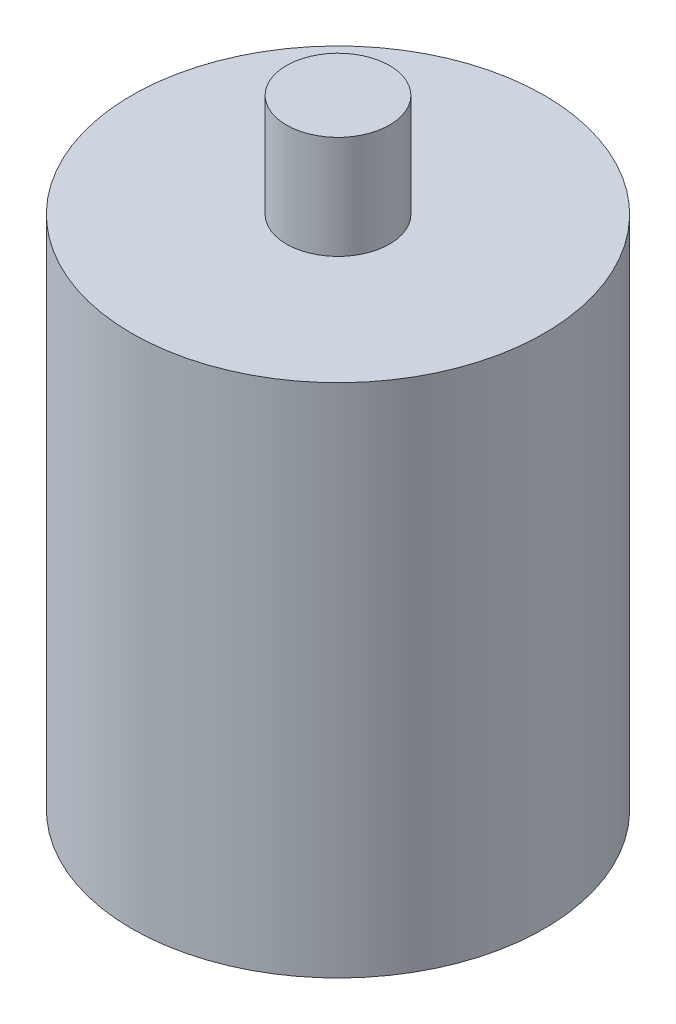
from build123d import *

# Parameters (mm, degrees)
SKETCH1_R           = 20
BOSS_EXTRUDE1_DEPTH = 50
SKETCH2_R           = 5
BOSS_EXTRUDE2_DEPTH = 10
SKETCH3_R           = 1.5
CUT_EXTRUDE1_DEPTH  = 16


with BuildPart() as part:
    # Sketch1 → Boss-Extrude1 (new body)
    with BuildSketch(Plane(origin=(0, 0, 0), x_dir=(1, 0, 0), z_dir=(0, 1, 0))):
        with Locations(Location((0, 0, 0), (0, 0, 270))):
            Circle(SKETCH1_R)
    extrude(amount=BOSS_EXTRUDE1_DEPTH)

    # Sketch2 → Boss-Extrude2 (add)
    with BuildSketch(Plane(origin=(0, 50, 0), x_dir=(1, 0, 0), z_dir=(0, 1, 0))):
        with Locations(Location((0, 0, 0), (0, 0, 270))):
            Circle(SKETCH2_R)
    extrude(amount=BOSS_EXTRUDE2_DEPTH)

    # Sketch3 → Cut-Extrude1 (cut)
    with BuildSketch(Plane.XY):
        with Locations((0, 55.836490144)):
            Circle(SKETCH3_R)
    extrude(amount=-CUT_EXTRUDE1_DEPTH, mode=Mode.SUBTRACT)


solid = part.part
